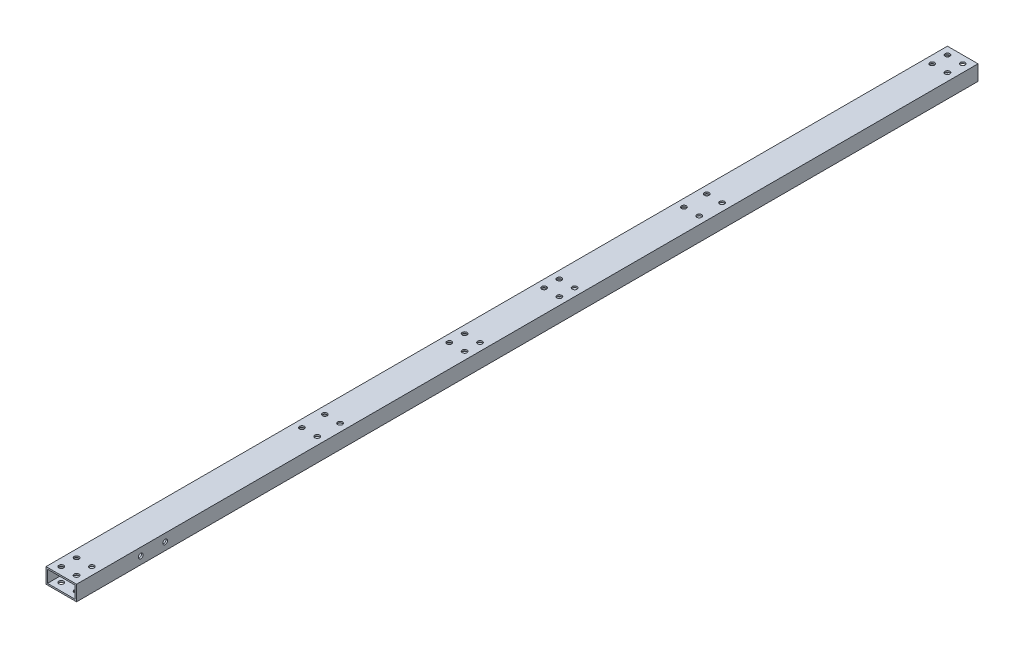
from build123d import *

# Parameters (mm, degrees)
SKETCH_1_W          = 20
SKETCH_1_H          = 10
SKETCH_1_W_2        = 18
SKETCH_1_H_2        = 8
EXTRUDE_1_DEPTH     = 590
SKETCH_2_R          = 1.575
CUT_EXTRUDE_1_DEPTH = 591.423576765
SKETCH_3_R          = 1.575
CUT_EXTRUDE_2_DEPTH = 591.423576765


with BuildPart() as part:
    # 草图1 → 拉伸-薄壁1 (new body)
    with BuildSketch(Plane.XY):
        with Locations((10, -5)):
            Rectangle(SKETCH_1_W, SKETCH_1_H)
        with Locations((10, -5)):
            Rectangle(SKETCH_1_W_2, SKETCH_1_H_2, mode=Mode.SUBTRACT)
    extrude(amount=EXTRUDE_1_DEPTH)

    # 草图2 → 切除-拉伸1 (cut, through all)
    with BuildSketch(Plane.XZ.offset(10)):
        with Locations(Location((5, 412.5, 0), (0, 0, 270))):
            Circle(SKETCH_2_R)
        with Locations(Location((15, 412.5, 0), (0, 0, 270))):
            Circle(SKETCH_2_R)
        with Locations(Location((15, 427.5, 0), (0, 0, 270))):
            Circle(SKETCH_2_R)
        with Locations(Location((5, 427.5, 0), (0, 0, 270))):
            Circle(SKETCH_2_R)
        with Locations(Location((5, 162.5, 0), (0, 0, 270))):
            Circle(SKETCH_2_R)
        with Locations(Location((15, 162.5, 0), (0, 0, 270))):
            Circle(SKETCH_2_R)
        with Locations(Location((15, 177.5, 0), (0, 0, 270))):
            Circle(SKETCH_2_R)
        with Locations(Location((5, 177.5, 0), (0, 0, 270))):
            Circle(SKETCH_2_R)
        with Locations(Location((5, 585, 0), (0, 0, 270))):
            Circle(SKETCH_2_R)
        with Locations(Location((15, 585, 0), (0, 0, 270))):
            Circle(SKETCH_2_R)
        with Locations(Location((15, 575, 0), (0, 0, 270))):
            Circle(SKETCH_2_R)
        with Locations(Location((5, 575, 0), (0, 0, 270))):
            Circle(SKETCH_2_R)
        with Locations(Location((5, 15, 0), (0, 0, 270))):
            Circle(SKETCH_2_R)
        with Locations(Location((15, 15, 0), (0, 0, 270))):
            Circle(SKETCH_2_R)
        with Locations(Location((15, 5, 0), (0, 0, 270))):
            Circle(SKETCH_2_R)
        with Locations(Location((5, 5, 0), (0, 0, 270))):
            Circle(SKETCH_2_R)
        with Locations(Location((5, 331, 0), (0, 0, 270))):
            Circle(SKETCH_2_R)
        with Locations(Location((15, 331, 0), (0, 0, 270))):
            Circle(SKETCH_2_R)
        with Locations(Location((5, 321, 0), (0, 0, 270))):
            Circle(SKETCH_2_R)
        with Locations(Location((15, 321, 0), (0, 0, 270))):
            Circle(SKETCH_2_R)
        with Locations(Location((15, 269, 0), (0, 0, 270))):
            Circle(SKETCH_2_R)
        with Locations(Location((5, 269, 0), (0, 0, 270))):
            Circle(SKETCH_2_R)
        with Locations(Location((15, 259, 0), (0, 0, 270))):
            Circle(SKETCH_2_R)
        with Locations(Location((5, 259, 0), (0, 0, 270))):
            Circle(SKETCH_2_R)
    extrude(amount=-CUT_EXTRUDE_1_DEPTH, mode=Mode.SUBTRACT)

    # 草图3 → 切除-拉伸2 (cut, through all)
    with BuildSketch(Plane.ZY):
        with Locations(Location((548, -5, 0), (0, 0, 270))):
            Circle(SKETCH_3_R)
        with Locations(Location((532, -5, 0), (0, 0, 270))):
            Circle(SKETCH_3_R)
    extrude(amount=-CUT_EXTRUDE_2_DEPTH, mode=Mode.SUBTRACT)


solid = part.part
